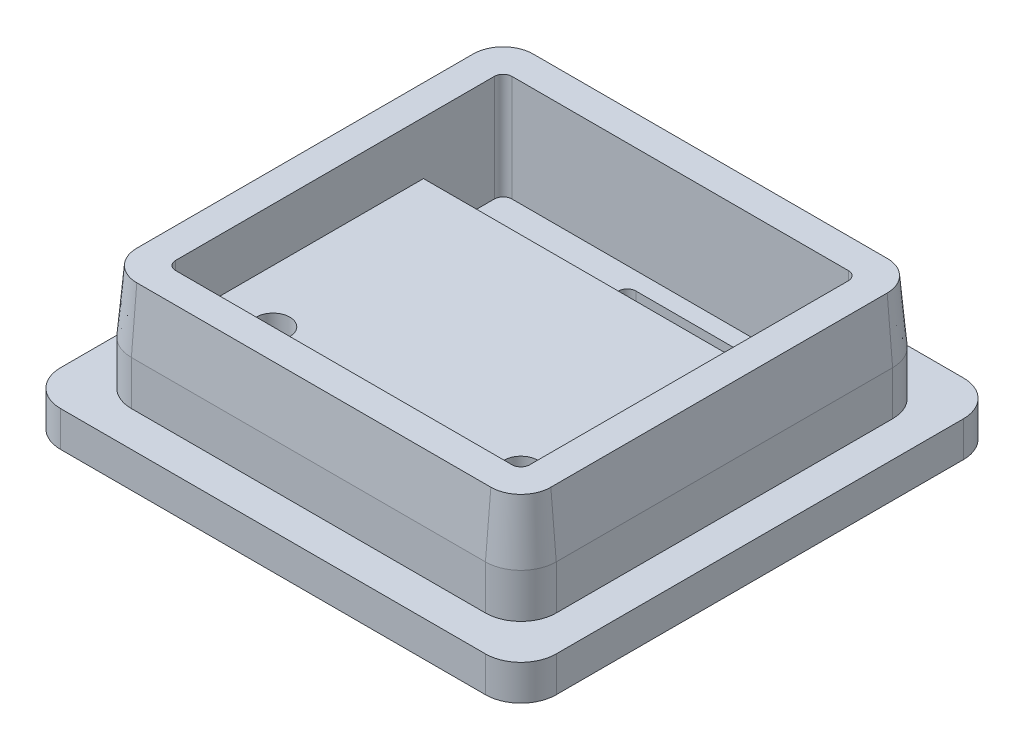
from build123d import *
from OCP.BRepFilletAPI import BRepFilletAPI_MakeChamfer

# Parameters (mm, degrees)
SKETCH1_W           = 28
SKETCH1_H           = 27
BOSS_EXTRUDE1_DEPTH = 2
SKETCH2_W           = 10
SKETCH2_H           = 2.5
CUT_EXTRUDE1_DEPTH  = 2
SKETCH3_W           = 20
SKETCH3_H           = 14.5
BOSS_EXTRUDE2_DEPTH = 3
SKETCH4_W           = 24
SKETCH4_H           = 23
SKETCH4_W_2         = 20
SKETCH4_H_2         = 19
BOSS_EXTRUDE3_DEPTH = 6
SKETCH5_R           = 0.95
CUT_EXTRUDE2_DEPTH  = 3.2
FILLET1_R           = 2
FILLET2_R           = 0.5
CHAMFER1_SIZE       = 3.5
CHAMFER1_SIZE2      = 0.306210322


with BuildPart() as part:
    # Sketch1 → Boss-Extrude1 (new body)
    with BuildSketch(Plane(origin=(0, 0, 0), x_dir=(1, 0, 0), z_dir=(0, 1, 0))):
        Rectangle(SKETCH1_W, SKETCH1_H)
    extrude(amount=BOSS_EXTRUDE1_DEPTH)

    # Sketch2 → Cut-Extrude1 (cut)
    with BuildSketch(Plane(origin=(0, 2, 0), x_dir=(1, 0, 0), z_dir=(0, 1, 0))):
        with Locations((3, 7.25)):
            Rectangle(SKETCH2_W, SKETCH2_H)
    extrude(amount=-CUT_EXTRUDE1_DEPTH, mode=Mode.SUBTRACT)

    # Sketch3 → Boss-Extrude2 (add)
    with BuildSketch(Plane(origin=(0, 2, 0), x_dir=(1, 0, 0), z_dir=(0, 1, 0))):
        with Locations((0, -2.25)):
            Rectangle(SKETCH3_W, SKETCH3_H)
    extrude(amount=BOSS_EXTRUDE2_DEPTH)

    # Sketch4 → Boss-Extrude3 (add)
    with BuildSketch(Plane(origin=(0, 2, 0), x_dir=(1, 0, 0), z_dir=(0, 1, 0))):
        Rectangle(SKETCH4_W, SKETCH4_H)
        Rectangle(SKETCH4_W_2, SKETCH4_H_2, mode=Mode.SUBTRACT)
    extrude(amount=BOSS_EXTRUDE3_DEPTH)

    # Sketch5 → Cut-Extrude2 (cut)
    with BuildSketch(Plane(origin=(0, 5, 0), x_dir=(1, 0, 0), z_dir=(0, 1, 0))):
        with Locations(Location((-7, -6.5, 0), (0, 0, 270))):
            Circle(SKETCH5_R)
        with Locations(Location((7, -6.5, 0), (0, 0, 90))):
            Circle(SKETCH5_R)
    extrude(amount=-CUT_EXTRUDE2_DEPTH, mode=Mode.SUBTRACT)

    # Fillet1
    fillet1_edges = [part.edges().sort_by_distance(p)[0] for p in [
        (12, 5, -11.5),
        (-12, 5, -11.5),
        (-12, 5, 11.5),
        (12, 5, 11.5),
        (14, 1, 13.5),
        (-14, 1, 13.5),
        (-14, 1, -13.5),
        (14, 1, -13.5),
    ]]
    fillet(fillet1_edges, radius=FILLET1_R)

    # Fillet2
    fillet2_edges = [part.edges().sort_by_distance(p)[0] for p in [
        (-2, 1, -8.5),
        (-2, 1, -6),
        (8, 1, -6),
        (8, 1, -8.5),
        (10, 5, -9.5),
        (-10, 6.5, 9.5),
        (10, 6.5, 9.5),
        (-10, 5, -9.5),
    ]]
    fillet(fillet2_edges, radius=FILLET2_R)

    # Chamfer1: one chamfer whose edges measure the first distance from different faces: ONE call of the kernel's chamfer builder (chamfer() names one face for all edges)
    chamfer1_edges_1 = [part.edges().sort_by_distance(p)[0] for p in [
        (0, 8, -11.5),
    ]]
    chamfer1_side_1 = [part.faces().sort_by_distance(p)[0] for p in [
        (0, 5, -11.5),
    ]]
    chamfer1_edges_2 = [part.edges().sort_by_distance(p)[0] for p in [
        (12, 8, 0),
    ]]
    chamfer1_side_2 = [part.faces().sort_by_distance(p)[0] for p in [
        (12, 5, 0),
    ]]
    chamfer1_edges_3 = [part.edges().sort_by_distance(p)[0] for p in [
        (-12, 8, 0),
    ]]
    chamfer1_side_3 = [part.faces().sort_by_distance(p)[0] for p in [
        (-12, 5, 0),
    ]]
    chamfer1_edges_4 = [part.edges().sort_by_distance(p)[0] for p in [
        (0, 8, 11.5),
    ]]
    chamfer1_side_4 = [part.faces().sort_by_distance(p)[0] for p in [
        (0, 5, 11.5),
    ]]
    chamfer1_edges_5 = [part.edges().sort_by_distance(p)[0] for p in [
        (-11.414213562, 8, -10.914213562),
    ]]
    chamfer1_side_5 = [part.faces().sort_by_distance(p)[0] for p in [
        (-11.414213562, 5, -10.914213562),
    ]]
    chamfer1_edges_6 = [part.edges().sort_by_distance(p)[0] for p in [
        (-11.414213562, 8, 10.914213562),
    ]]
    chamfer1_side_6 = [part.faces().sort_by_distance(p)[0] for p in [
        (-11.414213562, 5, 10.914213562),
    ]]
    chamfer1_edges_7 = [part.edges().sort_by_distance(p)[0] for p in [
        (11.414213562, 8, 10.914213562),
    ]]
    chamfer1_side_7 = [part.faces().sort_by_distance(p)[0] for p in [
        (11.414213562, 5, 10.914213562),
    ]]
    chamfer1_edges_8 = [part.edges().sort_by_distance(p)[0] for p in [
        (11.414213562, 8, -10.914213562),
    ]]
    chamfer1_side_8 = [part.faces().sort_by_distance(p)[0] for p in [
        (11.414213562, 5, -10.914213562),
    ]]
    chamfer1 = BRepFilletAPI_MakeChamfer(part.part.solid().wrapped)
    for e in chamfer1_edges_1:
        chamfer1.Add(CHAMFER1_SIZE, CHAMFER1_SIZE2, e.wrapped, chamfer1_side_1[0].wrapped)  # the first distance lies on this face
    for e in chamfer1_edges_2:
        chamfer1.Add(CHAMFER1_SIZE, CHAMFER1_SIZE2, e.wrapped, chamfer1_side_2[0].wrapped)  # the first distance lies on this face
    for e in chamfer1_edges_3:
        chamfer1.Add(CHAMFER1_SIZE, CHAMFER1_SIZE2, e.wrapped, chamfer1_side_3[0].wrapped)  # the first distance lies on this face
    for e in chamfer1_edges_4:
        chamfer1.Add(CHAMFER1_SIZE, CHAMFER1_SIZE2, e.wrapped, chamfer1_side_4[0].wrapped)  # the first distance lies on this face
    for e in chamfer1_edges_5:
        chamfer1.Add(CHAMFER1_SIZE, CHAMFER1_SIZE2, e.wrapped, chamfer1_side_5[0].wrapped)  # the first distance lies on this face
    for e in chamfer1_edges_6:
        chamfer1.Add(CHAMFER1_SIZE, CHAMFER1_SIZE2, e.wrapped, chamfer1_side_6[0].wrapped)  # the first distance lies on this face
    for e in chamfer1_edges_7:
        chamfer1.Add(CHAMFER1_SIZE, CHAMFER1_SIZE2, e.wrapped, chamfer1_side_7[0].wrapped)  # the first distance lies on this face
    for e in chamfer1_edges_8:
        chamfer1.Add(CHAMFER1_SIZE, CHAMFER1_SIZE2, e.wrapped, chamfer1_side_8[0].wrapped)  # the first distance lies on this face
    add(Compound.cast(chamfer1.Shape()), mode=Mode.REPLACE)


solid = part.part
